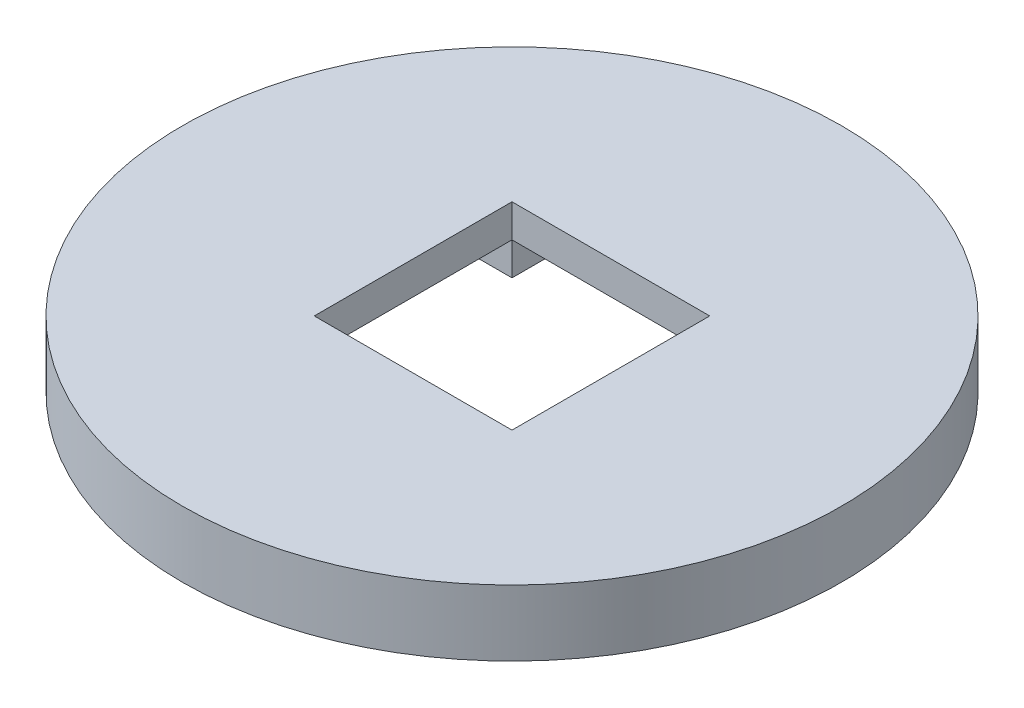
from build123d import *

# Parameters (mm, degrees)
SKETCH2_R           = 50
BOSS_EXTRUDE1_DEPTH = 10
SKETCH4_W           = 30
SKETCH4_H           = 30
CUT_EXTRUDE4_DEPTH  = 72.414284285
SKETCH4_5_W         = 30
SKETCH4_5_H         = 15
SKETCH4_5_W_2       = 15
SKETCH4_5_H_2       = 30
CUT_EXTRUDE5_DEPTH  = 5


with BuildPart() as part:
    # Sketch2 → Boss-Extrude1 (new body)
    with BuildSketch(Plane(origin=(0, 0, 0), x_dir=(1, 0, 0), z_dir=(0, 1, 0))):
        Circle(SKETCH2_R)
    extrude(amount=BOSS_EXTRUDE1_DEPTH)

    # Sketch4 → Cut-Extrude4 (cut, through all)
    with BuildSketch(Plane.XZ):
        Rectangle(SKETCH4_W, SKETCH4_H)
    extrude(amount=-CUT_EXTRUDE4_DEPTH, mode=Mode.SUBTRACT)

    # Sketch4<5> → Cut-Extrude5 (cut)
    with BuildSketch(Plane.XZ):
        with Locations((0, 22.5)):
            Rectangle(SKETCH4_5_W, SKETCH4_5_H)
        with Locations((-22.5, 0)):
            Rectangle(SKETCH4_5_W_2, SKETCH4_5_H_2)
        with Locations((22.5, 0)):
            Rectangle(SKETCH4_5_W_2, SKETCH4_5_H_2)
        with Locations((0, -22.5)):
            Rectangle(SKETCH4_5_W, SKETCH4_5_H)
    extrude(amount=-CUT_EXTRUDE5_DEPTH, mode=Mode.SUBTRACT)


solid = part.part
